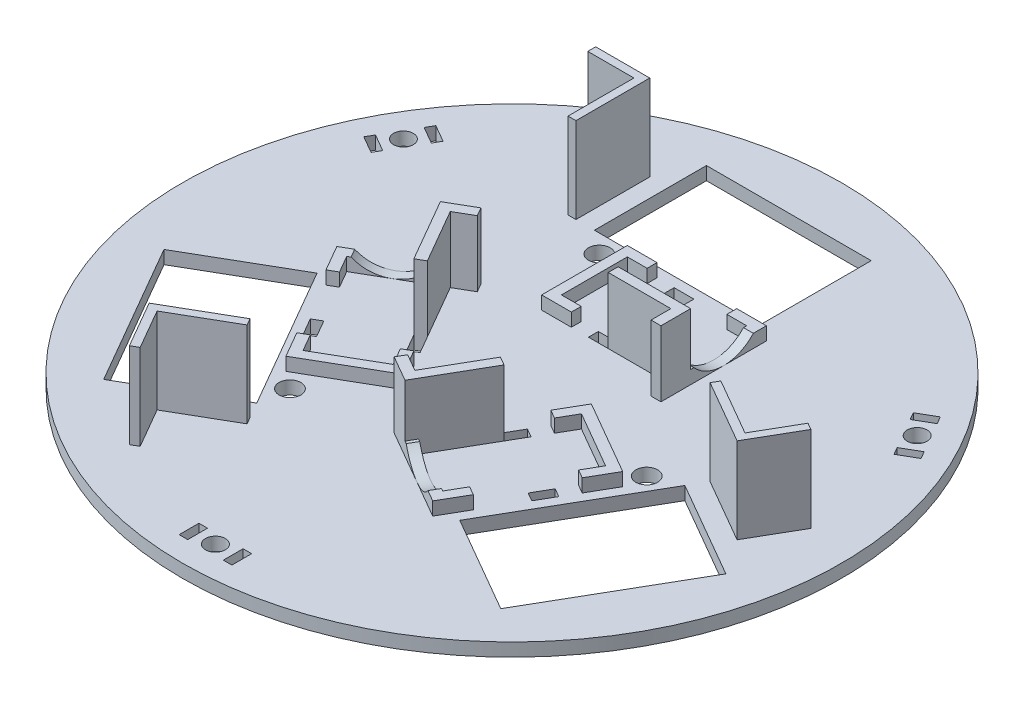
from build123d import *

# Parameters (mm, degrees)
SKETCH_1_R               = 50
SKETCH_1_W               = 25
SKETCH_1_H               = 17
EXTRUDE_1_DEPTH          = 2
EXTRUDE_2_DEPTH          = 2
SKETCH_3_R               = 6.1
CUT_EXTRUDE_1_DEPTH      = 3
SKETCH_4_W               = 3
SKETCH_4_H               = 1.5
CUT_EXTRUDE_2_DEPTH      = 3
PATTERN_CIRCULAR_2_COUNT = 3
SKETCH_5_R               = 1.5
SKETCH_5_W               = 1.3
SKETCH_5_H               = 3
CUT_EXTRUDE_3_DEPTH      = 3
PATTERN_CIRCULAR_3_COUNT = 3
EXTRUDE_3_DEPTH          = 10
PATTERN_CIRCULAR_6_COUNT = 3
EXTRUDE_4_DEPTH          = 13
PATTERN_CIRCULAR_7_COUNT = 3
SKETCH_10_R              = 1.65
CUT_EXTRUDE_4_DEPTH      = 8
PATTERN_CIRCULAR_8_COUNT = 3


with BuildPart() as part:
    # 草图1 → 凸台-拉伸1 (new body)
    with BuildSketch(Plane(origin=(0, 0, 0), x_dir=(1, 0, 0), z_dir=(0, 1, 0))):
        with Locations(Location((0, 0, 0), (0, 0, 270))):
            Circle(SKETCH_1_R)
        Polygon((42.623066959, -10.174682453), (27.900635095, -1.674682453), (15.400635095, -23.325317547), (30.123066959, -31.825317547), align=None, mode=Mode.SUBTRACT)
        with Locations((0, 33.5)):
            Rectangle(SKETCH_1_W, SKETCH_1_H, mode=Mode.SUBTRACT)
        Polygon((-30.123066959, -31.825317547), (-15.400635095, -23.325317547), (-27.900635095, -1.674682453), (-42.623066959, -10.174682453), align=None, mode=Mode.SUBTRACT)
    extrude(amount=-EXTRUDE_1_DEPTH)

    # 草图2 → 凸台-拉伸2 (add)
    with BuildSketch(Plane(origin=(0, 0, 0), x_dir=(1, 0, 0), z_dir=(0, 1, 0))):
        Polygon((10.6, 23.5), (10.6, 22), (13.6, 22), (13.6, 12), (10.6, 12), (10.6, 10.5), (15.1, 10.5), (15.1, 23.5), align=None)
        Polygon((-4.5, 12), (-4.5, 22), (-1.5, 22), (-1.5, 23.5), (-6, 23.5), (-6, 10.5), (-1.5, 10.5), (-1.5, 12), align=None)
    extrude_2 = extrude(amount=EXTRUDE_2_DEPTH)

    # 草图3 → 切除-拉伸1 (cut)
    with BuildSketch(Plane(origin=(15.1, 0, 0), x_dir=(0, 0, -1), z_dir=(1, 0, 0))):
        with Locations((17, 6.1)):
            Circle(SKETCH_3_R)
    cut_extrude_1 = extrude(amount=-CUT_EXTRUDE_1_DEPTH, mode=Mode.SUBTRACT)

    # 草图4 → 切除-拉伸2 (cut)
    with BuildSketch(Plane(origin=(0, 0, 0), x_dir=(1, 0, 0), z_dir=(0, 1, 0))):
        with Locations((2.6, 22.75)):
            Rectangle(SKETCH_4_W, SKETCH_4_H)
        with Locations((2.6, 11.25)):
            Rectangle(SKETCH_4_W, SKETCH_4_H)
    cut_extrude_2 = extrude(amount=-CUT_EXTRUDE_2_DEPTH, mode=Mode.SUBTRACT)

    # 阵列(圆周)2: 凸台-拉伸2, 切除-拉伸1, 切除-拉伸2 ×3 about axis
    pattern_circular_2_axis = Axis((0, 0, 0), (0, 1, 0))
    add([extrude_2.rotate(pattern_circular_2_axis, i * 360 / PATTERN_CIRCULAR_2_COUNT) for i in range(1, PATTERN_CIRCULAR_2_COUNT)])
    add([cut_extrude_1.rotate(pattern_circular_2_axis, i * 360 / PATTERN_CIRCULAR_2_COUNT) for i in range(1, PATTERN_CIRCULAR_2_COUNT)], mode=Mode.SUBTRACT)
    add([cut_extrude_2.rotate(pattern_circular_2_axis, i * 360 / PATTERN_CIRCULAR_2_COUNT) for i in range(1, PATTERN_CIRCULAR_2_COUNT)], mode=Mode.SUBTRACT)

    # 草图5 → 切除-拉伸3 (cut)
    with BuildSketch(Plane(origin=(0, 0, 0), x_dir=(1, 0, 0), z_dir=(0, 1, 0))):
        with Locations(Location((0, -45, 0), (0, 0, 270))):
            Circle(SKETCH_5_R)
        with Locations((-3.35, -45)):
            Rectangle(SKETCH_5_W, SKETCH_5_H)
        with Locations((3.35, -45)):
            Rectangle(SKETCH_5_W, SKETCH_5_H)
    cut_extrude_3 = extrude(amount=-CUT_EXTRUDE_3_DEPTH, mode=Mode.SUBTRACT)

    # 阵列(圆周)3: 切除-拉伸3 ×3 about axis
    pattern_circular_3_axis = Axis((0, 0, 0), (0, 1, 0))
    for i in range(1, PATTERN_CIRCULAR_3_COUNT):
        add(cut_extrude_3.rotate(pattern_circular_3_axis, i * 360 / PATTERN_CIRCULAR_3_COUNT), mode=Mode.SUBTRACT)

    # 草图8 → 凸台-拉伸3 (add)
    with BuildSketch(Plane(origin=(0, 0, 0), x_dir=(1, 0, 0), z_dir=(0, 1, 0))):
        Polygon((4.1, 12), (15.1, 12), (15.1, 10.5), (15.1, 7.5), (13.6, 7.5), (13.6, 10.5), (4.1, 10.5), align=None)
    extrude_3 = extrude(amount=EXTRUDE_3_DEPTH)

    # 阵列(圆周)6: 凸台-拉伸3 ×3 about axis
    pattern_circular_6_axis = Axis((0, 0, 0), (0, 1, 0))
    for i in range(1, PATTERN_CIRCULAR_6_COUNT):
        add(extrude_3.rotate(pattern_circular_6_axis, i * 360 / PATTERN_CIRCULAR_6_COUNT))

    # 草图9 → 凸台-拉伸4 (add)
    with BuildSketch(Plane(origin=(0, 0, 0), x_dir=(1, 0, 0), z_dir=(0, 1, 0))):
        Polygon((-16.5, 35), (-16.5, 25), (-15.3, 25), (-15.3, 36.2), (-23.5, 36.2), (-23.5, 35), align=None)
    extrude_4 = extrude(amount=EXTRUDE_4_DEPTH)

    # 阵列(圆周)7: 凸台-拉伸4 ×3 about axis
    pattern_circular_7_axis = Axis((0, 0, 0), (0, 1, 0))
    for i in range(1, PATTERN_CIRCULAR_7_COUNT):
        add(extrude_4.rotate(pattern_circular_7_axis, i * 360 / PATTERN_CIRCULAR_7_COUNT))

    # 草图10 → 切除-拉伸4 (cut)
    with BuildSketch(Plane(origin=(0, 0, 0), x_dir=(1, 0, 0), z_dir=(0, 1, 0))):
        with Locations(Location((23.767848868, -3.330069097, 0), (0, 0, 270))):
            Circle(SKETCH_10_R)
    cut_extrude_4 = extrude(amount=-CUT_EXTRUDE_4_DEPTH, mode=Mode.SUBTRACT)

    # 阵列(圆周)8: 切除-拉伸4 ×3 about axis
    pattern_circular_8_axis = Axis((0, 0, 0), (0, 1, 0))
    for i in range(1, PATTERN_CIRCULAR_8_COUNT):
        add(cut_extrude_4.rotate(pattern_circular_8_axis, i * 360 / PATTERN_CIRCULAR_8_COUNT), mode=Mode.SUBTRACT)


solid = part.part
